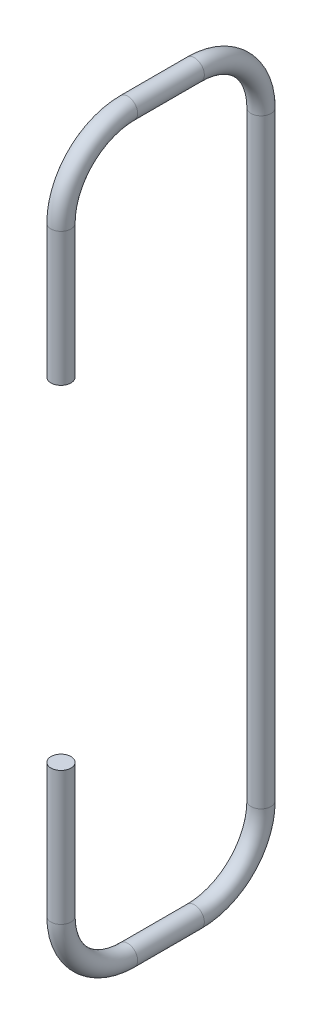
from build123d import *

# Parameters (mm, degrees)
SKETCH_2_R = 1.5


with BuildPart() as part:
    # По траектории1: sweep along a path in Эскиз1
    with BuildLine(Plane(origin=(0, 0, 0), x_dir=(0, 0, -1), z_dir=(1, 0, 0))) as sweep_1_path:
        Line((0, 0), (0, 45))
        ThreePointArc((0, 45), (-2.928932188, 52.071067812), (-10, 55))
        Line((-10, 55), (-20, 55))
        ThreePointArc((-20, 55), (-27.071067812, 52.071067812), (-30, 45))
        Line((-30, 45), (-30, 25))
    # Эскиз2 → По траектории1 (sweep)
    with BuildSketch(Plane(origin=(0, 0, 0), x_dir=(1, 0, 0), z_dir=(0, 1, 0))):
        Circle(SKETCH_2_R)
    sweep(path=sweep_1_path.line)

    # Зеркальное отражение1: part across plane


with BuildPart() as part_1:
    add(part.part)
    add(part.part.mirror(Plane.ZX))


solid = part_1.part
